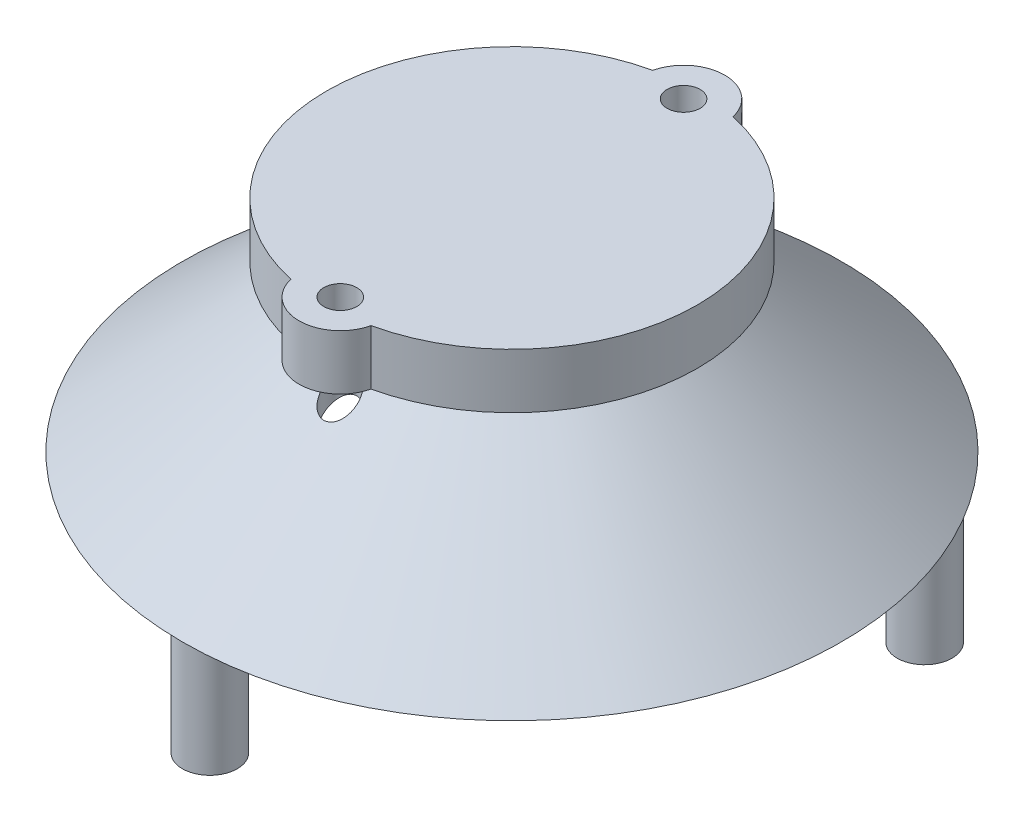
from build123d import *

# Parameters (mm, degrees)
BOSS_EXTRUDE4_DEPTH = 2
BOSS_EXTRUDE3_REACH = 22.785
PEG_R               = 1
SKETCH4_R           = 0.6
CUT_EXTRUDE1_DEPTH  = 21.784609806


with BuildPart() as part:
    # Sketch1 → Boss-Extrude4 (new body)
    with BuildSketch(Plane(origin=(0, 0, 0), x_dir=(1, 0, 0), z_dir=(0, 1, 0))):
        with BuildLine():
            ThreePointArc((1.460958589, -6.59), (6.75, 0), (1.460958589, 6.59))
            ThreePointArc((1.460958589, 6.59), (0, 7.75), (-1.460958589, 6.59))
            ThreePointArc((-1.460958589, 6.59), (-6.75, 0), (-1.460958589, -6.59))
            ThreePointArc((-1.460958589, -6.59), (0, -7.75), (1.460958589, -6.59))
        make_face()
    extrude(amount=BOSS_EXTRUDE4_DEPTH)

    # Sketch3 → Revolve1 (revolve)
    with BuildSketch(Plane(origin=(0, 0, 0), x_dir=(0, 0, -1), z_dir=(1, 0, 0))):
        Polygon((-4, 0), (-5, 0), (-12, -6), (-11, -6), align=None)
    revolve(axis=Axis((0, 0.65, 0), (0, -1, 0)))

    # Peg → Boss-Extrude3 (add, up to next)
    with BuildSketch(Plane(origin=(0, -10, 0), x_dir=(1, 0, 0), z_dir=(0, 1, 0)), mode=Mode.PRIVATE) as boss_extrude3_sk1:
        with Locations((0, -11)):
            Circle(PEG_R)
    boss_extrude3_tool1 = extrude(boss_extrude3_sk1.sketch, amount=BOSS_EXTRUDE3_REACH, mode=Mode.PRIVATE) - part.part
    # Peg → Boss-Extrude3 (add, up to next)
    with BuildSketch(Plane(origin=(0, -10, 0), x_dir=(1, 0, 0), z_dir=(0, 1, 0)), mode=Mode.PRIVATE) as boss_extrude3_sk2:
        with Locations((-9.526279442, 5.5)):
            Circle(PEG_R)
    boss_extrude3_tool2 = extrude(boss_extrude3_sk2.sketch, amount=BOSS_EXTRUDE3_REACH, mode=Mode.PRIVATE) - part.part
    # Peg → Boss-Extrude3 (add, up to next)
    with BuildSketch(Plane(origin=(0, -10, 0), x_dir=(1, 0, 0), z_dir=(0, 1, 0)), mode=Mode.PRIVATE) as boss_extrude3_sk3:
        with Locations((9.526279442, 5.5)):
            Circle(PEG_R)
    boss_extrude3_tool3 = extrude(boss_extrude3_sk3.sketch, amount=BOSS_EXTRUDE3_REACH, mode=Mode.PRIVATE) - part.part
    add(boss_extrude3_tool1.solids().sort_by_distance((0, -10, 11))[0])
    add(boss_extrude3_tool2.solids().sort_by_distance((-9.526279, -10, -5.5))[0])
    add(boss_extrude3_tool3.solids().sort_by_distance((9.526279, -10, -5.5))[0])

    # Sketch4 → Cut-Extrude1 (cut, through all)
    with BuildSketch(Plane(origin=(0, 2, 0), x_dir=(1, 0, 0), z_dir=(0, 1, 0))):
        with Locations((0, 6.25)):
            Circle(SKETCH4_R)
        with Locations((0, -6.25)):
            Circle(SKETCH4_R)
    extrude(amount=-CUT_EXTRUDE1_DEPTH, mode=Mode.SUBTRACT)


solid = part.part
